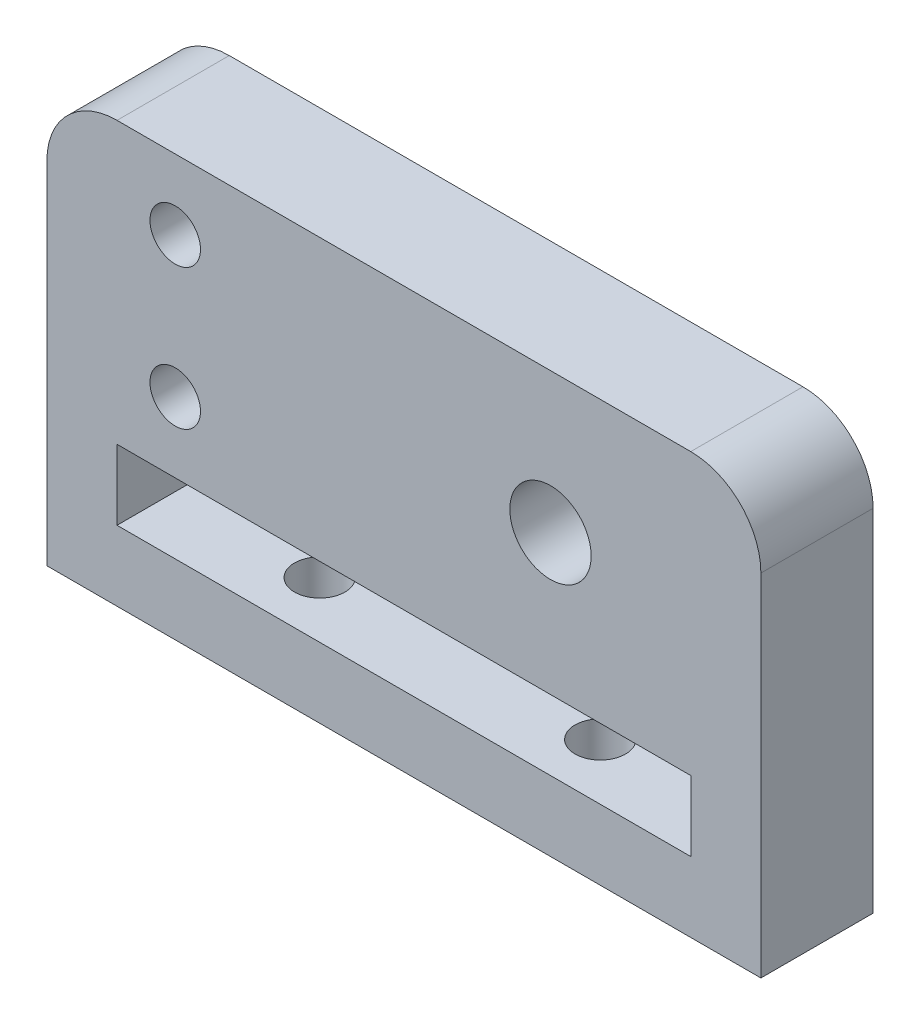
from build123d import *

# Parameters (mm, degrees)
ESQUISSE1_W             = 50.9
ESQUISSE1_H             = 30
ESQUISSE1_R             = 2.9
ESQUISSE1_W_2           = 40.9
ESQUISSE1_H_2           = 5
BOSS_EXTRU_1_DEPTH      = 8
ESQUISSE2_R             = 1.8
ENL_V_MAT_EXTRU_1_DEPTH = 15
CONG_1_R                = 5
ESQUISSE3_R             = 1.8
ENL_V_MAT_EXTRU_2_DEPTH = 10
ESQUISSE4_R             = 3.5
ENL_V_MAT_EXTRU_3_DEPTH = 3.5


with BuildPart() as part:
    # Esquisse1 → Boss.-Extru.1 (new body)
    with BuildSketch(Plane.XY):
        with Locations((25.45, 15)):
            Rectangle(ESQUISSE1_W, ESQUISSE1_H)
        with Locations((35.9, 20)):
            Circle(ESQUISSE1_R, mode=Mode.SUBTRACT)
        with Locations((25.45, 7.5)):
            Rectangle(ESQUISSE1_W_2, ESQUISSE1_H_2, mode=Mode.SUBTRACT)
    extrude(amount=BOSS_EXTRU_1_DEPTH)

    # Esquisse2 → Enlèv. mat.-Extru.1 (cut)
    with BuildSketch(Plane.XZ):
        with Locations(Location((15.45, 4, 0), (0, 0, 270))):
            Circle(ESQUISSE2_R)
        with Locations(Location((35.45, 4, 0), (0, 0, 270))):
            Circle(ESQUISSE2_R)
    extrude(amount=-ENL_V_MAT_EXTRU_1_DEPTH, mode=Mode.SUBTRACT)

    # Congé1
    cong_1_edges = [part.edges().sort_by_distance(p)[0] for p in [
        (0, 30, 4),
        (50.9, 30, 4),
    ]]
    fillet(cong_1_edges, radius=CONG_1_R)

    # Esquisse3 → Enlèv. mat.-Extru.2 (cut)
    with BuildSketch(Plane(origin=(0, 0, 0), x_dir=(-1, 0, 0), z_dir=(0, 0, -1))):
        with Locations((-9.15, 25)):
            Circle(ESQUISSE3_R)
        with Locations((-9.15, 15)):
            Circle(ESQUISSE3_R)
    extrude(amount=-ENL_V_MAT_EXTRU_2_DEPTH, mode=Mode.SUBTRACT)

    # Esquisse4 → Enlèv. mat.-Extru.3 (cut)
    with BuildSketch(Plane.XZ.offset(-10)):
        with Locations((15.45, 4)):
            Circle(ESQUISSE4_R)
        with Locations((35.45, 4)):
            Circle(ESQUISSE4_R)
    extrude(amount=-ENL_V_MAT_EXTRU_3_DEPTH, mode=Mode.SUBTRACT)


solid = part.part
